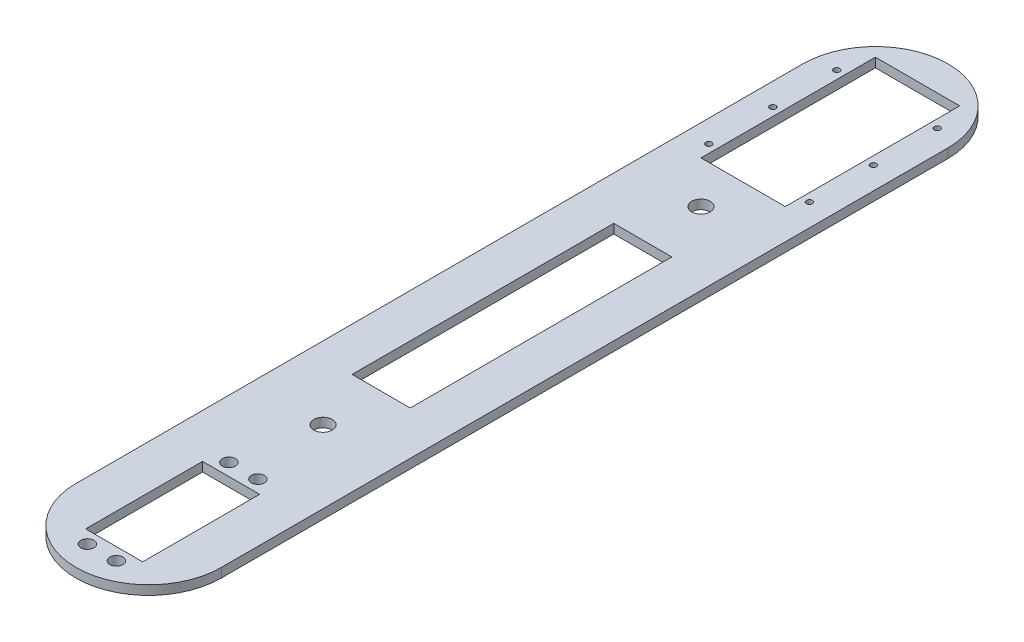
from build123d import *

# Parameters (mm, degrees)
SKETCH2_W           = 50
SKETCH2_H           = 300
BOSS_EXTRUDE1_DEPTH = 3.175
SKETCH3_R           = 1.025
SKETCH3_R_2         = 2.25
SKETCH3_W           = 29
SKETCH3_H           = 60
SKETCH3_W_2         = 19.62
SKETCH3_H_2         = 40.22
CUT_EXTRUDE1_DEPTH  = 6.35
CUT_EXTRUDE2_DEPTH  = 6.35
SKETCH5_R           = 3.175
SKETCH5_W           = 20
SKETCH5_H           = 90
CUT_EXTRUDE3_DEPTH  = 6.35


with BuildPart() as part:
    # Sketch2 → Boss-Extrude1 (new body)
    with BuildSketch(Plane(origin=(0, 0, 0), x_dir=(1, 0, 0), z_dir=(0, 1, 0))):
        with Locations((25, -150)):
            Rectangle(SKETCH2_W, SKETCH2_H)
    extrude(amount=BOSS_EXTRUDE1_DEPTH)

    # Sketch3 → Cut-Extrude1 (cut)
    with BuildSketch(Plane(origin=(0, 3.175, 0), x_dir=(1, 0, 0), z_dir=(0, 1, 0))):
        with Locations(Location((7.7, -21, 0), (0, 0, 270))):
            Circle(SKETCH3_R)
        with Locations(Location((7.7, -43, 0), (0, 0, 270))):
            Circle(SKETCH3_R)
        with Locations(Location((7.7, -65, 0), (0, 0, 270))):
            Circle(SKETCH3_R)
        with Locations(Location((42.3, -65, 0), (0, 0, 270))):
            Circle(SKETCH3_R)
        with Locations(Location((42.3, -43, 0), (0, 0, 270))):
            Circle(SKETCH3_R)
        with Locations(Location((42.3, -21, 0), (0, 0, 270))):
            Circle(SKETCH3_R)
        with Locations(Location((20, -291.07, 0), (0, 0, 270))):
            Circle(SKETCH3_R_2)
        with Locations(Location((30, -291.07, 0), (0, 0, 270))):
            Circle(SKETCH3_R_2)
        with Locations(Location((20, -242.39, 0), (0, 0, 270))):
            Circle(SKETCH3_R_2)
        with Locations(Location((30, -242.39, 0), (0, 0, 270))):
            Circle(SKETCH3_R_2)
        with Locations((25, -40.5)):
            Rectangle(SKETCH3_W, SKETCH3_H)
        with Locations((25, -266.73)):
            Rectangle(SKETCH3_W_2, SKETCH3_H_2)
    extrude(amount=-CUT_EXTRUDE1_DEPTH, mode=Mode.SUBTRACT)

    # Sketch4 → Cut-Extrude2 (cut)
    with BuildSketch(Plane(origin=(0, 3.175, 0), x_dir=(1, 0, 0), z_dir=(0, 1, 0))):
        with BuildLine():
            Line((0, 0), (0, -25))
            ThreePointArc((0, -25), (7.32233047, -7.32233047), (25, 0))
            Line((25, 0), (0, 0))
        make_face()
        with BuildLine():
            ThreePointArc((25, 0), (42.67766953, -7.32233047), (50, -25))
            Line((50, -25), (50, 0))
            Line((50, 0), (25, 0))
        make_face()
        with BuildLine():
            ThreePointArc((25, -300), (7.32233047, -292.67766953), (0, -275))
            Line((0, -275), (0, -300))
            Line((0, -300), (25, -300))
        make_face()
        with BuildLine():
            Line((50, -300), (50, -275))
            ThreePointArc((50, -275), (42.67766953, -292.67766953), (25, -300))
            Line((25, -300), (50, -300))
        make_face()
    extrude(amount=-CUT_EXTRUDE2_DEPTH, mode=Mode.SUBTRACT)

    # Sketch5 → Cut-Extrude3 (cut)
    with BuildSketch(Plane.XZ):
        with Locations(Location((25, 215, 0), (0, 0, 270))):
            Circle(SKETCH5_R)
        with Locations(Location((25, 85, 0), (0, 0, 90))):
            Circle(SKETCH5_R)
        with Locations((25, 150)):
            Rectangle(SKETCH5_W, SKETCH5_H)
    extrude(amount=-CUT_EXTRUDE3_DEPTH, mode=Mode.SUBTRACT)


solid = part.part
